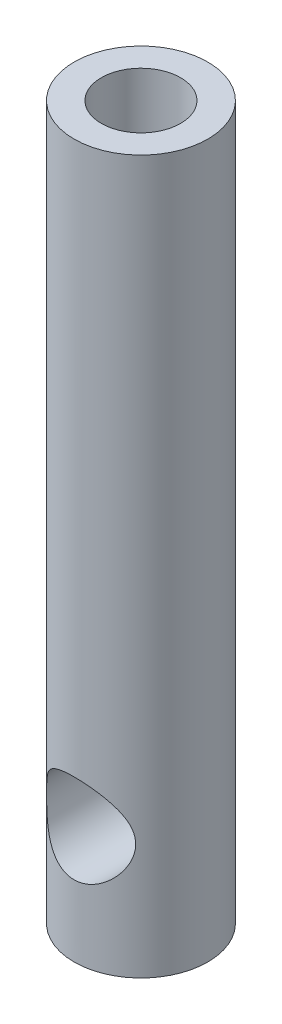
from build123d import *

# Parameters (mm, degrees)
SKETCH1_R                 = 1.905
BOSS_EXTRUDE1_DEPTH       = 20.32
F_4_40_TAPPED_HOLE1_D     = 2.2606
F_4_40_TAPPED_HOLE1_DEPTH = 7.62
F_4_40_TAPPED_HOLE1_TIP   = 0.679152758
CUT_EXTRUDE1_DEPTH        = 21.497815737
CUT_EXTRUDE1_DEPTH_BACK   = 21.497815737
SKETCH4_R                 = 1.27


with BuildPart() as part:
    # Sketch1 → Boss-Extrude1 (new body)
    with BuildSketch(Plane(origin=(0, 0, 0), x_dir=(1, 0, 0), z_dir=(0, 1, 0))):
        with Locations(Location((0, 0, 0), (0, 0, 270))):
            Circle(SKETCH1_R)
    extrude(amount=-BOSS_EXTRUDE1_DEPTH)

    # #4-40 Tapped Hole1
    with Locations(Plane(origin=(0, 0, 0), x_dir=(1, 0, 0), z_dir=(0, 1, 0))):
        with Locations((0, 0)):
            Hole(F_4_40_TAPPED_HOLE1_D / 2, depth=F_4_40_TAPPED_HOLE1_DEPTH)
            with Locations((0, 0, -(F_4_40_TAPPED_HOLE1_DEPTH + F_4_40_TAPPED_HOLE1_TIP / 2))):  # 118° drill point
                Cone(0, F_4_40_TAPPED_HOLE1_D / 2, F_4_40_TAPPED_HOLE1_TIP, mode=Mode.SUBTRACT)

    # Sketch4 → Cut-Extrude1 (cut, two sides: drawn at the far end of the back side and taken through both)
    with BuildSketch(Plane.XY.offset(-CUT_EXTRUDE1_DEPTH_BACK)):
        with Locations(Location((0, -17.018, 0), (0, 0, 90.000000002))):
            Circle(SKETCH4_R)
    extrude(amount=CUT_EXTRUDE1_DEPTH + CUT_EXTRUDE1_DEPTH_BACK, mode=Mode.SUBTRACT)


solid = part.part
